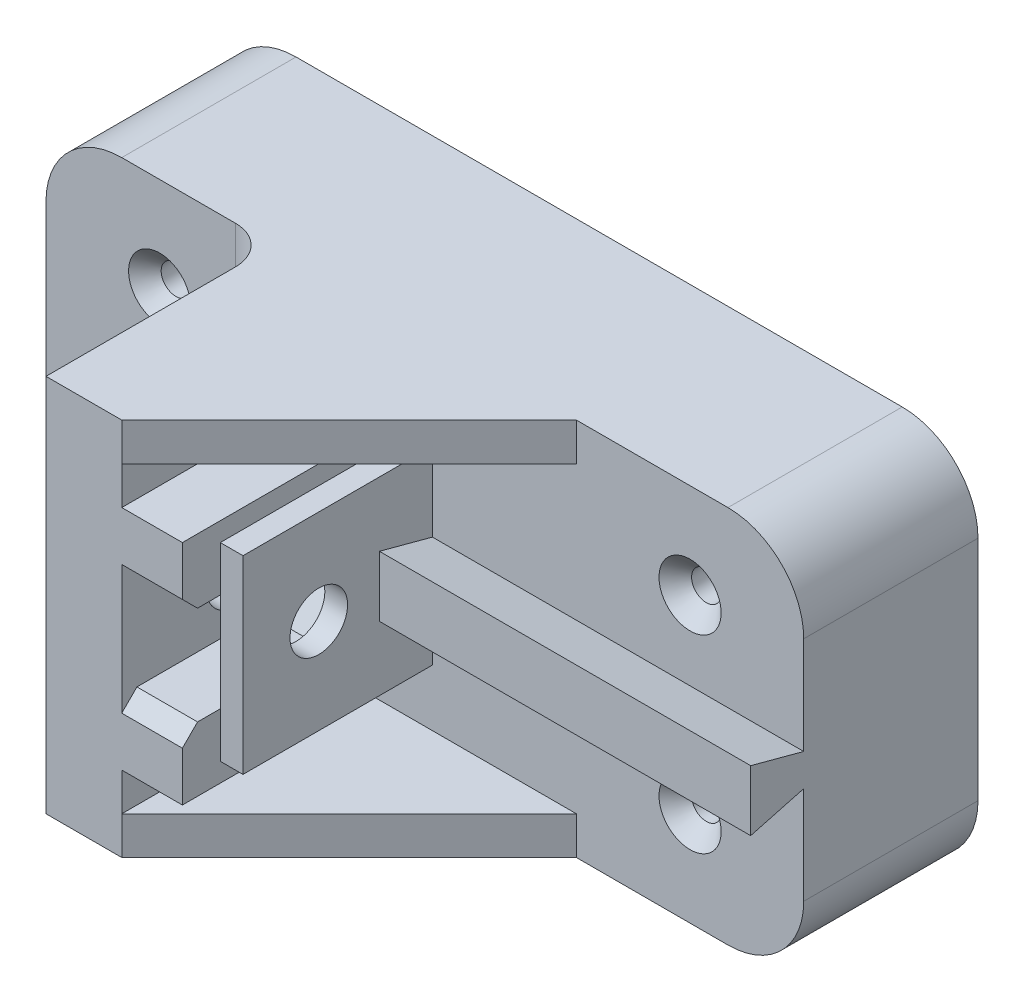
from build123d import *

# Parameters (mm, degrees)
SCHIZZO1_W                   = 50
SCHIZZO1_H                   = 23
ESTRUSIONE_ESTRUSIONE1_DEPTH = 100
SCHIZZO2_W                   = 10
SCHIZZO2_H                   = 50
ESTRUSIONE_ESTRUSIONE2_DEPTH = 30
M7_CLEARANCE_HOLE1_D         = 7.6
ESTRUSIONE_ESTRUSIONE3_DEPTH = 60
NERVATURA2_REACH             = 125.73
SCHIZZO10_WALL_W             = 291.885494398
SCHIZZO10_WALL_H             = 5
SCHIZZO11_W                  = 30
SCHIZZO11_H                  = 30
ESTRUSIONE_ESTRUSIONE4_DEPTH = 8
TAGLIO_ESTRUSIONE1_DEPTH     = 8
RACCORDO1_R                  = 10
SMUSSO2_SIZE                 = 2
RACCORDO2_R                  = 5
SCHIZZO17_W                  = 25
SCHIZZO17_H                  = 25
ESTRUSIONE_ESTRUSIONE8_DEPTH = 3
M7_CLEARANCE_HOLE2_D         = 7.6


with BuildPart() as part:
    # Schizzo1 → Estrusione-Estrusione1 (new body)
    with BuildSketch(Plane.YZ):
        with Locations((0, 11.5)):
            Rectangle(SCHIZZO1_W, SCHIZZO1_H)
    extrude(amount=ESTRUSIONE_ESTRUSIONE1_DEPTH)

    # Schizzo2 → Estrusione-Estrusione2 (add)
    with BuildSketch(Plane.XY.offset(23)):
        with Locations((35, 0)):
            Rectangle(SCHIZZO2_W, SCHIZZO2_H)
    extrude(amount=ESTRUSIONE_ESTRUSIONE2_DEPTH)

    # M7 Clearance Hole1 (through all)
    with Locations(Plane.ZY.offset(-30)):
        with Locations((38, 0)):
            Hole(M7_CLEARANCE_HOLE1_D / 2)

    # Schizzo5 → Estrusione-Estrusione3 (add)
    with BuildSketch(Plane.YZ.offset(40)):
        Polygon((-2.124355653, 23), (2.124355653, 23), (4, 30), (-4, 30), align=None)
    extrude(amount=ESTRUSIONE_ESTRUSIONE3_DEPTH)

    # Schizzo10 wall → Nervatura2 (add, up to next)
    with BuildSketch(Plane(origin=(55, -25, 38), x_dir=(0.707106781187, 0, -0.707106781187), z_dir=(0.707106781187, 0, 0.707106781187)), mode=Mode.PRIVATE) as nervatura2_sk1:
        with Locations((0, 2.5)):
            Rectangle(SCHIZZO10_WALL_W, SCHIZZO10_WALL_H)
    nervatura2_tool1 = extrude(nervatura2_sk1.sketch, amount=-NERVATURA2_REACH, mode=Mode.PRIVATE) - part.part
    nervatura2 = nervatura2_tool1.solids().sort_by_distance((55, -25, 38))[0]
    add(nervatura2)

    # Specchia2: Nervatura2 across plane
    add(nervatura2.mirror(Plane.ZX))

    # Schizzo11 → Estrusione-Estrusione4 (add)
    with BuildSketch(Plane.YZ.offset(40)):
        with Locations((0, 38)):
            Rectangle(SCHIZZO11_W, SCHIZZO11_H)
    extrude(amount=ESTRUSIONE_ESTRUSIONE4_DEPTH)

    # Schizzo13 → Taglio-Estrusione1 (cut)
    with BuildSketch(Plane.YZ.offset(48)):
        Polygon((-6.5, 41.75277675), (-6.5, 34.24722325), (0, 30.494446501), (6.5, 34.24722325), (6.5, 41.75277675), (6.5, 53), (-6.5, 53), align=None)
    extrude(amount=-TAGLIO_ESTRUSIONE1_DEPTH, mode=Mode.SUBTRACT)

    # Schizzo16 → CSK for M3.5 Oval Head Machine Screw1 (revolve, cut)
    with BuildSketch(Plane(origin=(15, -12.5, 23), x_dir=(0, -1, 0), z_dir=(1, 0, 0))):
        Polygon((0, 0), (0, 31.171678207), (1.95, 30), (1.95, 2.15), (4.1, 0), align=None)
    csk_for_m3_5_oval_head_machine_screw1 = revolve(axis=Axis((15, -12.5, 29.35), (0, 0, -1)), mode=Mode.SUBTRACT)

    # Specchia3: CSK for M3.5 Oval Head Machine Screw1 across plane
    add(csk_for_m3_5_oval_head_machine_screw1.mirror(Plane.ZY.offset(-50)), mode=Mode.SUBTRACT)

    # Specchia3 at the second plane: CSK for M3.5 Oval Head Machine Screw1 across plane
    add(csk_for_m3_5_oval_head_machine_screw1.mirror(Plane.ZX), mode=Mode.SUBTRACT)

    # Specchia3 at the second plane copy 1 ske → Specchia3 at the second plane copy 1 (revolve, cut)
    with BuildSketch(Plane(origin=(85, 12.5, 23), x_dir=(0, 1, 0), z_dir=(-1, 0, 0))):
        Polygon((0, 0), (0, 31.171678207), (1.95, 30), (1.95, 2.15), (4.1, 0), align=None)
    revolve(axis=Axis((85, 12.5, 29.35), (0, 0, -1)), mode=Mode.SUBTRACT)

    # Raccordo1
    raccordo1_edges = [part.edges().sort_by_distance(p)[0] for p in [
        (100, 25, 11.5),
        (100, -25, 11.5),
        (0, 25, 11.5),
        (0, -25, 11.5),
    ]]
    fillet(raccordo1_edges, radius=RACCORDO1_R)

    # Smusso2
    smusso2_edges = [part.edges().sort_by_distance(p)[0] for p in [
        (44, 6.5, 53),
        (44, -6.5, 53),
    ]]
    chamfer(smusso2_edges, length=SMUSSO2_SIZE)

    # Raccordo2
    raccordo2_edges = [part.edges().sort_by_distance(p)[0] for p in [
        (30, 0, 23),
    ]]
    fillet(raccordo2_edges, radius=RACCORDO2_R)

    # Schizzo17 → Estrusione-Estrusione8 (add)
    with BuildSketch(Plane.YZ.offset(48)):
        with Locations((0, 35.5)):
            Rectangle(SCHIZZO17_W, SCHIZZO17_H)
    extrude(amount=ESTRUSIONE_ESTRUSIONE8_DEPTH)

    # M7 Clearance Hole2 (through all)
    with Locations(Plane(origin=(51, 0, 0), x_dir=(0, 0, -1), z_dir=(1, 0, 0))):
        with Locations((-38, 0)):
            Hole(M7_CLEARANCE_HOLE2_D / 2)


solid = part.part
